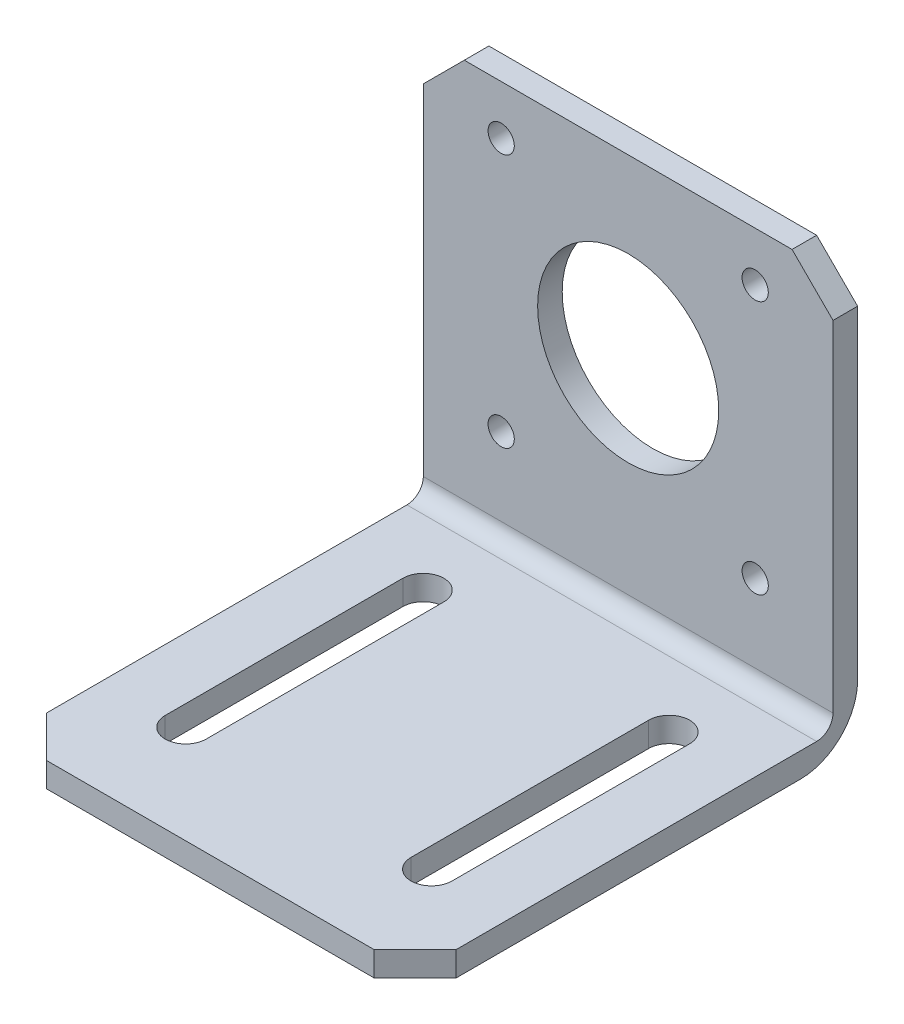
from build123d import *

# Parameters (mm, degrees)
SKETCH1_W           = 50
SKETCH1_H           = 51.5
BOSS_EXTRUDE1_DEPTH = 3
SKETCH2_W           = 50
SKETCH2_H           = 3
BOSS_EXTRUDE2_DEPTH = 51
SKETCH3_R           = 11.05
SKETCH3_R_2         = 1.6
CUT_EXTRUDE1_DEPTH  = 90.823437921
CUT_EXTRUDE2_DEPTH  = 89.137676393
CHAMFER1_SIZE       = 5
FILLET1_R           = 7
FILLET2_R           = 2


with BuildPart() as part:
    # Sketch1 → Boss-Extrude1 (new body)
    with BuildSketch(Plane.XY):
        with Locations((25, 25.75)):
            Rectangle(SKETCH1_W, SKETCH1_H)
    extrude(amount=BOSS_EXTRUDE1_DEPTH)

    # Sketch2 → Boss-Extrude2 (add)
    with BuildSketch(Plane.XY.offset(3)):
        with Locations((25, 1.5)):
            Rectangle(SKETCH2_W, SKETCH2_H)
    extrude(amount=BOSS_EXTRUDE2_DEPTH)

    # Sketch3 → Cut-Extrude1 (cut, through all)
    with BuildSketch(Plane(origin=(0, 0, 0), x_dir=(-1, 0, 0), z_dir=(0, 0, -1))):
        with Locations((-25, 30)):
            Circle(SKETCH3_R)
        with Locations((-40.5, 45.5)):
            Circle(SKETCH3_R_2)
        with Locations((-9.5, 45.5)):
            Circle(SKETCH3_R_2)
        with Locations((-9.5, 14.5)):
            Circle(SKETCH3_R_2)
        with Locations((-40.5, 14.5)):
            Circle(SKETCH3_R_2)
    extrude(amount=-CUT_EXTRUDE1_DEPTH, mode=Mode.SUBTRACT)

    # Sketch4 → Cut-Extrude2 (cut, through all)
    with BuildSketch(Plane(origin=(0, 3, 0), x_dir=(1, 0, 0), z_dir=(0, 1, 0))):
        with BuildLine():
            Line((12.5, -13), (12.5, -42))
            ThreePointArc((12.5, -42), (10, -44.5), (7.5, -42))
            Line((7.5, -42), (7.5, -13))
            ThreePointArc((7.5, -13), (10, -10.5), (12.5, -13))
        make_face()
        with BuildLine():
            Line((37.5, -42), (37.5, -13))
            ThreePointArc((37.5, -13), (40, -10.5), (42.5, -13))
            Line((42.5, -13), (42.5, -42))
            ThreePointArc((42.5, -42), (40, -44.5), (37.5, -42))
        make_face()
    extrude(amount=-CUT_EXTRUDE2_DEPTH, mode=Mode.SUBTRACT)

    # Chamfer1
    chamfer1_edges = [part.edges().sort_by_distance(p)[0] for p in [
        (0, 1.5, 54),
        (50, 1.5, 54),
        (0, 51.5, 1.5),
        (50, 51.5, 1.5),
    ]]
    chamfer(chamfer1_edges, length=CHAMFER1_SIZE)

    # Fillet1
    fillet1_edges = [part.edges().sort_by_distance(p)[0] for p in [
        (25, 0, 0),
    ]]
    fillet(fillet1_edges, radius=FILLET1_R)

    # Fillet2
    fillet2_edges = [part.edges().sort_by_distance(p)[0] for p in [
        (25, 3, 3),
    ]]
    fillet(fillet2_edges, radius=FILLET2_R)


solid = part.part
